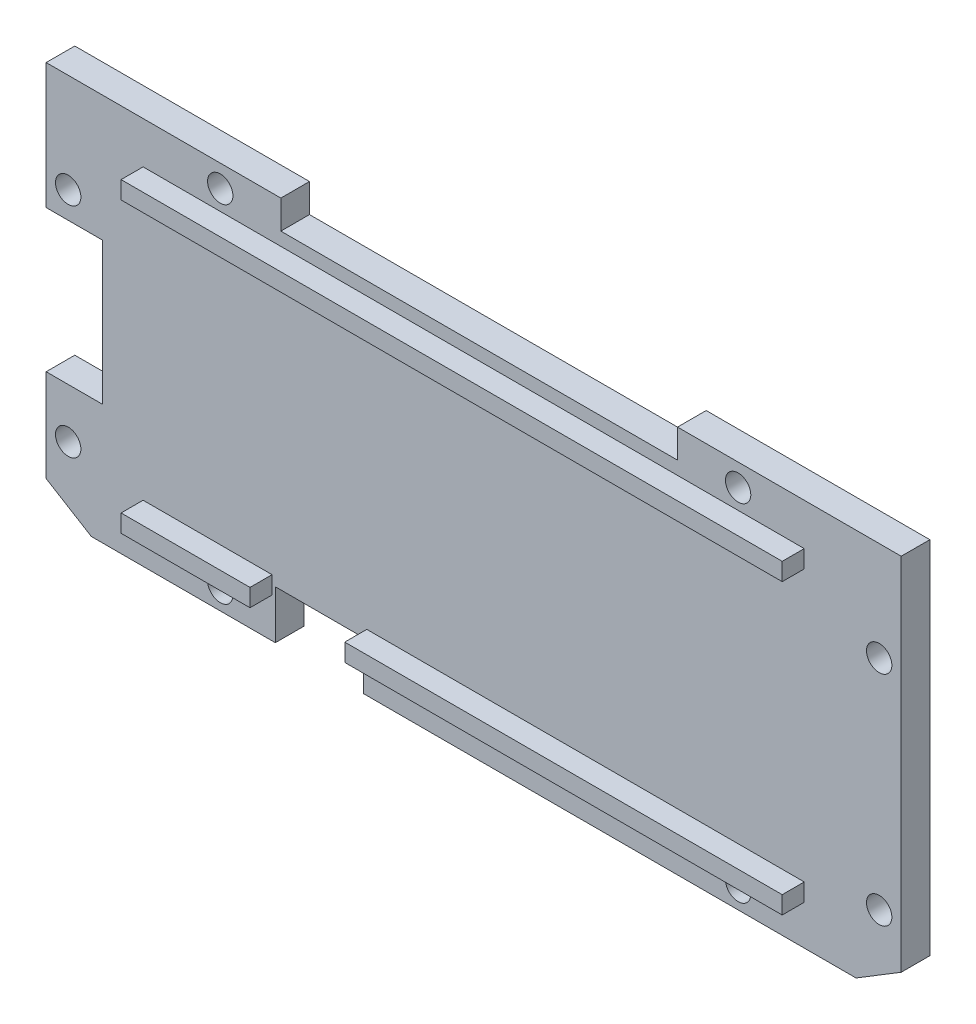
from build123d import *

# Parameters (mm, degrees)
TRIMMED_UPPER_SHELF_CABLE_NOTCH_AN_2_R       = 1.15
TRIMMED_UPPER_SHELF_CABLE_NOTCH_AND_AN_DEPTH = 2.6
PCB_START                                    = 2.6
PCB_EDGE_RESTS_WITH_ANTENNA_GAP_PROFILE_W    = 11.7
PCB_EDGE_RESTS_WITH_ANTENNA_GAP_PROFILE_H    = 1.6
PCB_EDGE_RESTS_WITH_ANTENNA_GAP_PROFILE_W_2  = 39.7
PCB_EDGE_RESTS_WITH_ANTENNA_GAP_PROFILE_W_3  = 60
PCB_EDGE_RESTS_WITH_ANTENNA_GAP_DEPTH        = 2


with BuildPart() as part:
    # Trimmed upper shelf - cable notch an 2 → Trimmed upper shelf - cable notch and an (new body)
    with BuildSketch(Plane.XY):
        Polygon((-38.8, -21.5), (-34.7, -24), (-18, -24), (-18, -19.6), (-10, -19.6), (-10, -24), (34.7, -24), (38.8, -21.5), (38.8, 11.2), (18.5, 11.2), (18.5, 8.6), (-17.5, 8.6), (-17.5, 11.2), (-38.8, 11.2), (-38.8, -0.2), (-33.7, -0.2), (-33.7, -13.1), (-38.8, -13.1), align=None)
        with Locations((-36.8, -17.6)):
            Circle(TRIMMED_UPPER_SHELF_CABLE_NOTCH_AN_2_R, mode=Mode.SUBTRACT)
        with Locations((36.8, -17.6)):
            Circle(TRIMMED_UPPER_SHELF_CABLE_NOTCH_AN_2_R, mode=Mode.SUBTRACT)
        with Locations((-36.8, 2.2)):
            Circle(TRIMMED_UPPER_SHELF_CABLE_NOTCH_AN_2_R, mode=Mode.SUBTRACT)
        with Locations((36.8, 2.2)):
            Circle(TRIMMED_UPPER_SHELF_CABLE_NOTCH_AN_2_R, mode=Mode.SUBTRACT)
        with Locations((-23, -22.2)):
            Circle(TRIMMED_UPPER_SHELF_CABLE_NOTCH_AN_2_R, mode=Mode.SUBTRACT)
        with Locations((24, -22.2)):
            Circle(TRIMMED_UPPER_SHELF_CABLE_NOTCH_AN_2_R, mode=Mode.SUBTRACT)
        with Locations((-23, 9.2)):
            Circle(TRIMMED_UPPER_SHELF_CABLE_NOTCH_AN_2_R, mode=Mode.SUBTRACT)
        with Locations((24, 9.2)):
            Circle(TRIMMED_UPPER_SHELF_CABLE_NOTCH_AN_2_R, mode=Mode.SUBTRACT)
    extrude(amount=TRIMMED_UPPER_SHELF_CABLE_NOTCH_AND_AN_DEPTH)

    # PCB edge rests with antenna gap profile → PCB edge rests with antenna gap (add)
    with BuildSketch(Plane.XY.offset(PCB_START)):
        with Locations((-24.15, -19.6)):
            Rectangle(PCB_EDGE_RESTS_WITH_ANTENNA_GAP_PROFILE_W, PCB_EDGE_RESTS_WITH_ANTENNA_GAP_PROFILE_H)
        with Locations((10.15, -19.6)):
            Rectangle(PCB_EDGE_RESTS_WITH_ANTENNA_GAP_PROFILE_W_2, PCB_EDGE_RESTS_WITH_ANTENNA_GAP_PROFILE_H)
        with Locations((0, 6.6)):
            Rectangle(PCB_EDGE_RESTS_WITH_ANTENNA_GAP_PROFILE_W_3, PCB_EDGE_RESTS_WITH_ANTENNA_GAP_PROFILE_H)
    extrude(amount=PCB_EDGE_RESTS_WITH_ANTENNA_GAP_DEPTH)


solid = part.part
